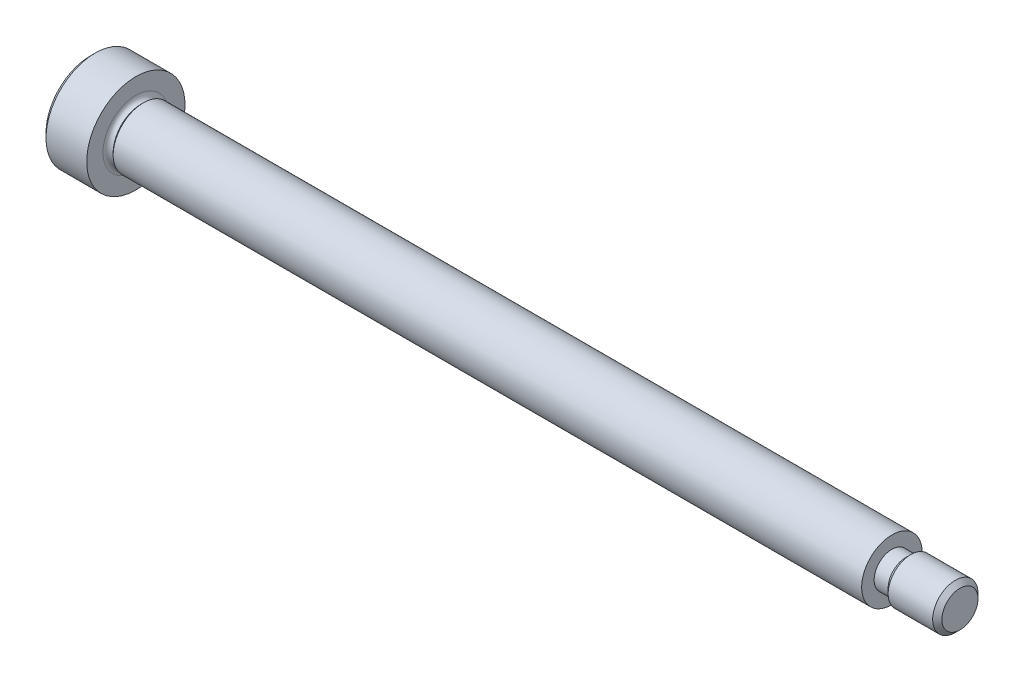
from build123d import *

# Parameters (mm, degrees)
SKETCH2_R           = 2.35
BOSS_EXTRUDE1_DEPTH = 1.85
SKETCH3_R           = 2.35
BOSS_EXTRUDE2_DEPTH = 0.65
BOSS_EXTRUDE2_DRAFT = -45
SKETCH4_R           = 3
BOSS_EXTRUDE3_DEPTH = 6.5
CUT_EXTRUDE1_DEPTH  = 3
CHAMFER1_SIZE       = 0.6135


with BuildPart() as part:
    # Sketch1 → Revolve1 (revolve)
    with BuildSketch(Plane.XY, mode=Mode.PRIVATE) as revolve1_sk:
        with BuildLine():
            Line((-6, 6.5), (-6, 0))
            Line((-6, 0), (100, 0))
            Line((100, 0), (100, 4))
            Line((100, 4), (1, 4))
            Line((1, 4), (0.7, 3.7))
            ThreePointArc((0.7, 3.7), (0.201222236, 3.864777793), (0, 4.35))
            Line((0, 4.35), (0, 6.5))
            Line((0, 6.5), (-6, 6.5))
        make_face()
    revolve(revolve1_sk.sketch.rotate(Axis((-6, 0, 0), (1, 0, 0)), 270), axis=Axis((-6, 0, 0), (1, 0, 0)))

    # Sketch2 → Boss-Extrude1 (add)
    with BuildSketch(Plane(origin=(100, 0, 0), x_dir=(0, 0, -1), z_dir=(1, 0, 0))):
        with Locations(Location((0, 0, 0), (0, 0, 180))):
            Circle(SKETCH2_R)
    extrude(amount=BOSS_EXTRUDE1_DEPTH)


with BuildPart() as boss_extrude2_tool:
    # Sketch3 → Boss-Extrude2 (with draft: the straight prism first)
    with BuildSketch(Plane(origin=(101.85, 0, 0), x_dir=(0, 0, -1), z_dir=(1, 0, 0))):
        with Locations(Location((0, 0, 0), (0, 0, 180))):
            Circle(SKETCH3_R)
    extrude(amount=BOSS_EXTRUDE2_DEPTH)
    # Boss-Extrude2: the draft: its side faces are tilted about the plane it starts from
    boss_extrude2_sides = [boss_extrude2_tool.faces().sort_by_distance(p)[0] for p in [
        (102.175, 0, -2.35),
    ]]
    draft(boss_extrude2_sides, Plane(origin=(101.85, 0, 0), x_dir=(0, 0, -1), z_dir=(1, 0, 0)), BOSS_EXTRUDE2_DRAFT)


with BuildPart() as part_1:
    add(part.part)

    # Boss-Extrude2: add boss_extrude2_tool
    add(boss_extrude2_tool.part)

    # Sketch4 → Boss-Extrude3 (add)
    with BuildSketch(Plane(origin=(102.5, 0, 0), x_dir=(0, 0, -1), z_dir=(1, 0, 0))):
        Circle(SKETCH4_R)
    extrude(amount=BOSS_EXTRUDE3_DEPTH)

    # Sketch5 → Cut-Extrude1 (cut)
    with BuildSketch(Plane.ZY.offset(6)):
        Polygon((0, -2.886751346), (2.5, -1.443375673), (2.5, 1.443375673), (0, 2.886751346), (-2.5, 1.443375673), (-2.5, -1.443375673), align=None)
    extrude(amount=-CUT_EXTRUDE1_DEPTH, mode=Mode.SUBTRACT)

    # Sketch6 → Cut-Revolve1 (revolve, cut)
    with BuildSketch(Plane.XY, mode=Mode.PRIVATE) as cut_revolve1_sk:
        Polygon((-3, 2.5), (-3, 0), (-1.556624327, 0), align=None)
    revolve(cut_revolve1_sk.sketch.rotate(Axis((-3, 0, 0), (1, 0, 0)), 270), axis=Axis((-3, 0, 0), (1, 0, 0)), mode=Mode.SUBTRACT)

    # Chamfer1
    chamfer1_edges = [part_1.edges().sort_by_distance(p)[0] for p in [
        (109, 0, 3),
        (-6, 0, 6.5),
    ]]
    chamfer(chamfer1_edges, length=CHAMFER1_SIZE)


solid = part_1.part
